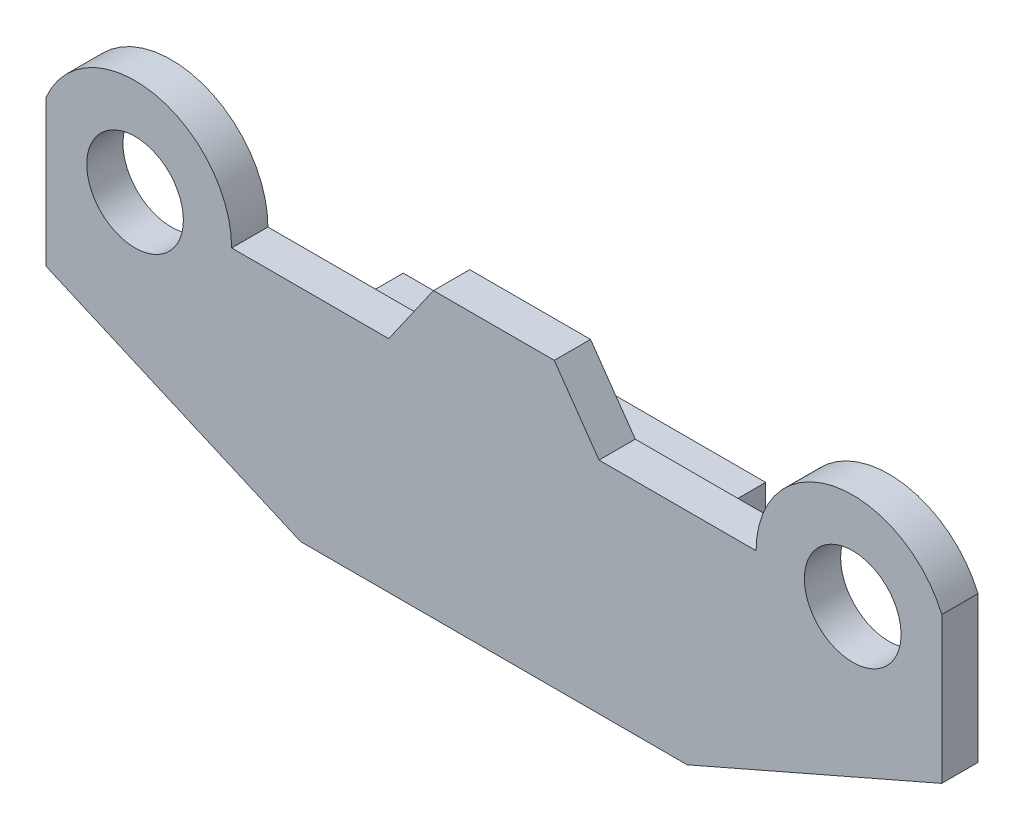
from build123d import *

# Parameters (mm, degrees)
SKETCH1_R           = 4
BOSS_EXTRUDE1_DEPTH = 3
SKETCH2_W           = 30
SKETCH2_H           = 15
BOSS_EXTRUDE2_DEPTH = 4.5


with BuildPart() as part:
    # Sketch1 → Boss-Extrude1 (new body)
    with BuildSketch(Plane.XY):
        with BuildLine():
            Line((-21.706018243, 0), (-8.706018243, 0))
            Line((-8.706018243, 0), (-5, 5.3))
            Line((-5, 5.3), (5, 5.3))
            Line((5, 5.3), (8.706018243, 0))
            Line((8.706018243, 0), (21.706018243, 0))
            ThreePointArc((21.706018243, 0), (28.120289405, 7.841266738), (37.077384256, 3.108530697))
            Line((37.077384256, 3.108530697), (37.077384256, -8.994356464))
            Line((37.077384256, -8.994356464), (16, -18.2))
            Line((16, -18.2), (-16, -18.2))
            Line((-16, -18.2), (-37.077384256, -8.994356464))
            Line((-37.077384256, -8.994356464), (-37.077384256, 3.108530697))
            ThreePointArc((-37.077384256, 3.108530697), (-28.120289405, 7.841266738), (-21.706018243, 0))
        make_face()
        with Locations((-29.706018243, 0)):
            Circle(SKETCH1_R, mode=Mode.SUBTRACT)
        with Locations(Location((29.706018243, 0, 0), (0, 0, 180))):
            Circle(SKETCH1_R, mode=Mode.SUBTRACT)
    extrude(amount=BOSS_EXTRUDE1_DEPTH)

    # Sketch2 → Boss-Extrude2 (add)
    with BuildSketch(Plane.XY):
        with Locations((0, -9.7)):
            Rectangle(SKETCH2_W, SKETCH2_H)
    extrude(amount=-BOSS_EXTRUDE2_DEPTH)


solid = part.part
